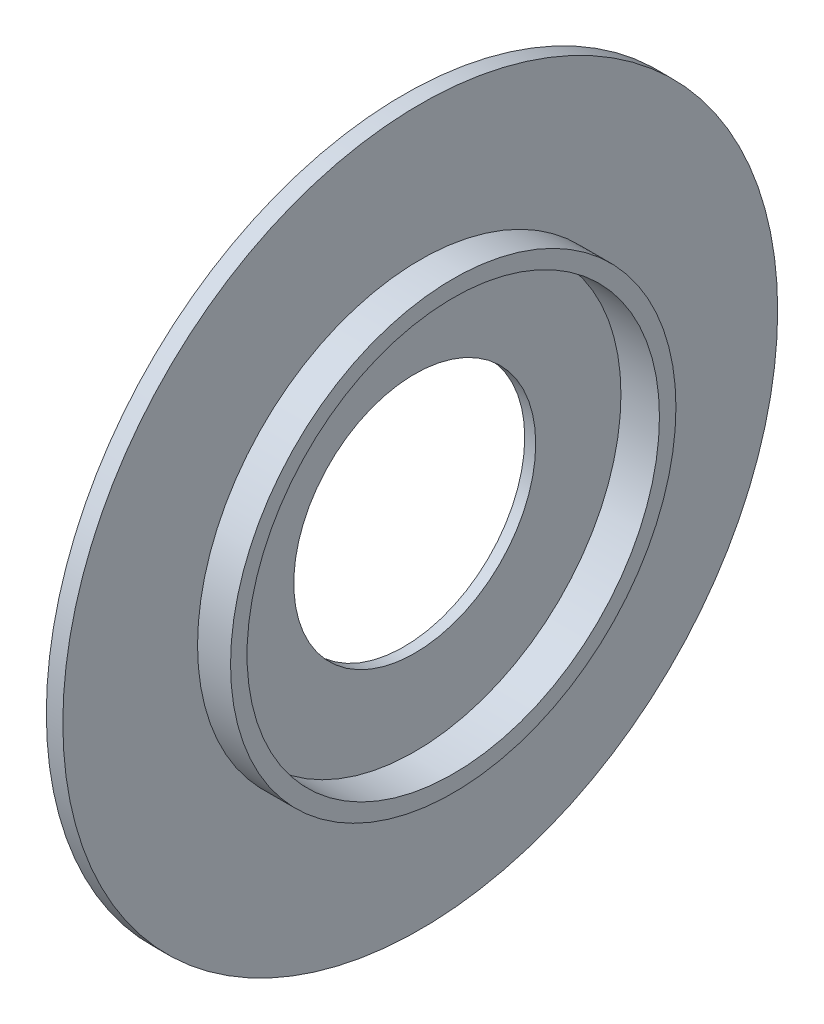
from build123d import *

# Parameters (mm, degrees)
SKETCH1_R               = 65
BULK_EXTRUDE_DEPTH      = 3
SKETCH2_R               = 40.5
SKETCH2_R_2             = 37.5
BEARING_RING_DEPTH      = 6
BEARING_START           = -1
SKETCH4_R               = 37.5
BEARING_CUT_DEPTH       = 1
SKETCH5_R               = 22
WIRE_PASSTHRU_CUT_DEPTH = 143.214667503


with BuildPart() as part:
    # Sketch1 → BULK EXTRUDE (new body)
    with BuildSketch(Plane(origin=(72, 0, 0), x_dir=(0, 0, -1), z_dir=(1, 0, 0))):
        with Locations((50, -18.372727273)):
            Circle(SKETCH1_R)
    extrude(amount=BULK_EXTRUDE_DEPTH)

    # Sketch2 → BEARING RING (add)
    with BuildSketch(Plane(origin=(75, 0, 0), x_dir=(0, 0, -1), z_dir=(1, 0, 0))):
        with Locations((50, -18.372727273)):
            Circle(SKETCH2_R)
        with Locations((50, -18.372727273)):
            Circle(SKETCH2_R_2, mode=Mode.SUBTRACT)
    extrude(amount=BEARING_RING_DEPTH)

    # Sketch4 → BEARING CUT (cut)
    with BuildSketch(Plane(origin=(75, 0, 0), x_dir=(0, 0, -1), z_dir=(1, 0, 0)).offset(BEARING_START)):
        with Locations((50, -18.372727273)):
            Circle(SKETCH4_R)
    extrude(amount=BEARING_CUT_DEPTH, mode=Mode.SUBTRACT)

    # Sketch5 → WIRE PASSTHRU CUT (cut, through all)
    with BuildSketch(Plane(origin=(74, 0, 0), x_dir=(0, 0, -1), z_dir=(1, 0, 0))):
        with Locations((50, -18.372727273)):
            Circle(SKETCH5_R)
    extrude(amount=-WIRE_PASSTHRU_CUT_DEPTH, mode=Mode.SUBTRACT)


solid = part.part
